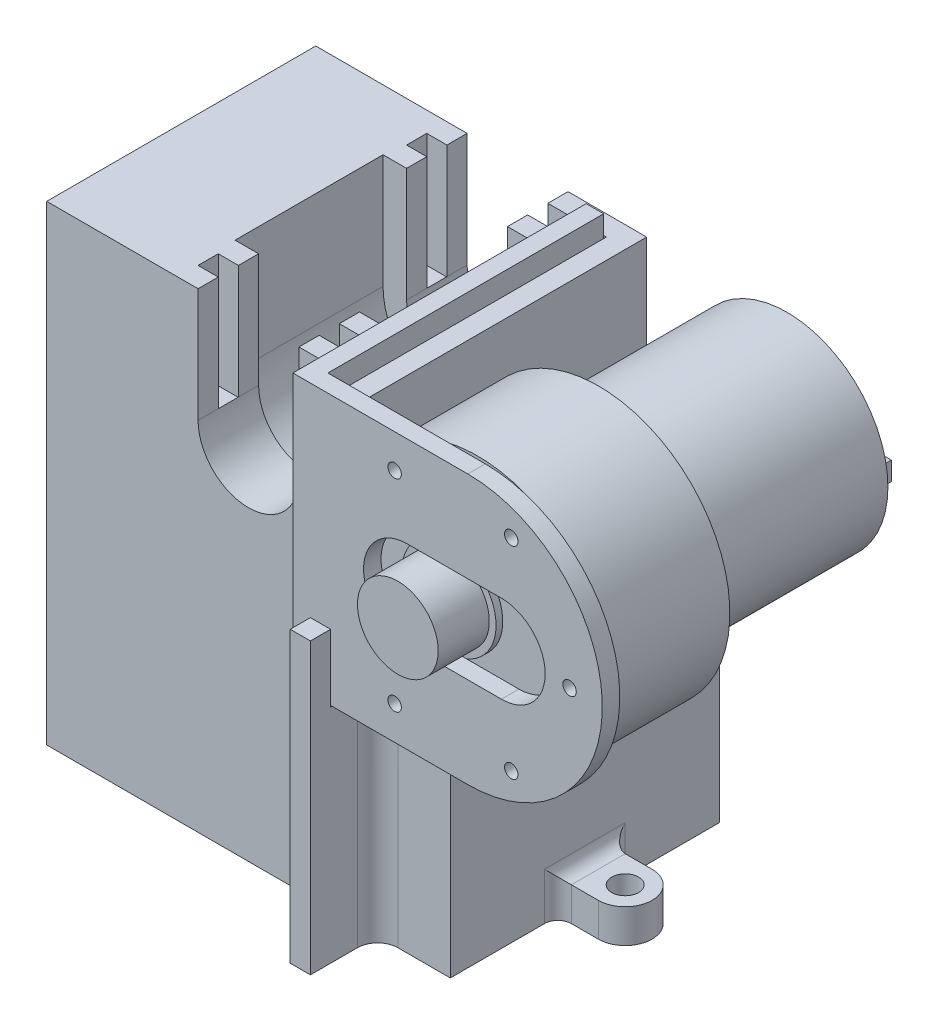
from build123d import *

# Parameters (mm, degrees)
SKETCH1_W       = 60
SKETCH1_H       = 40
EXTRUDE1_DEPTH  = 70
EXTRUDE2_DEPTH  = 173.409396496
SKETCH5_R       = 7.5
EXTRUDE3_DEPTH  = 173.409396496
SKETCH8_R       = 11
EXTRUDE5_DEPTH  = 11
SKETCH9_W       = 15
SKETCH9_H       = 16.95
EXTRUDE6_DEPTH  = 173.409396496
SKETCH10_W      = 22
SKETCH10_H      = 31.344818361
EXTRUDE7_DEPTH  = 11
SKETCH13_W      = 3
SKETCH13_H      = 17
EXTRUDE9_DEPTH  = 3
SKETCH14_W      = 3
SKETCH14_H      = 17
EXTRUDE10_DEPTH = 3
SKETCH16_W      = 3
SKETCH16_H      = 37
EXTRUDE11_DEPTH = 41
SKETCH17_W      = 3
SKETCH17_H      = 37
EXTRUDE12_DEPTH = 6
SKETCH18_W      = 3
SKETCH18_H      = 10
EXTRUDE13_DEPTH = 33
SKETCH19_W      = 3
SKETCH19_H      = 3
EXTRUDE14_DEPTH = 10
FILLET1_R       = 3
SKETCH20_R      = 2
EXTRUDE15_DEPTH = 5
FILLET2_R       = 2
FILLET3_R       = 2
EXTRUDE16_DEPTH = 40
FILLET4_RADIUS  = 20
FILLET4_LENGTH  = 2.6
EXTRUDE17_DEPTH = 2.6
SKETCH24_R      = 1
EXTRUDE18_DEPTH = 2.6
SKETCH25_R      = 2.5
EXTRUDE19_DEPTH = 2.6
SKETCH26_R      = 6
EXTRUDE20_DEPTH = 5
SKETCH27_R      = 6
EXTRUDE21_DEPTH = 2.6
SKETCH28_R      = 7
EXTRUDE22_DEPTH = 1
SKETCH29_R      = 19.5
EXTRUDE23_DEPTH = 18
SKETCH30_R      = 15
EXTRUDE24_DEPTH = 28
SKETCH31_W      = 1.052605107
SKETCH31_H      = 2.780967683
SKETCH31_W_2    = 1.226574425
EXTRUDE25_DEPTH = 3


with BuildPart() as part:
    # Sketch1 → Extrude1 (new body)
    with BuildSketch(Plane(origin=(0, 5, 0), x_dir=(1, 0, 0), z_dir=(0, 1, 0))):
        with Locations((-120, 0)):
            Rectangle(SKETCH1_W, SKETCH1_H)
    extrude(amount=EXTRUDE1_DEPTH)

    # Sketch4 → Extrude2 (cut, through all)
    with BuildSketch(Plane.XY.offset(20)):
        Polygon((-106.8, 75), (-106.8, 38), (-69.340811885, 38), (-69.340811885, 101.678315396), (-106.8, 101.678315396), align=None)
    extrude(amount=-EXTRUDE2_DEPTH, mode=Mode.SUBTRACT)

    # Sketch5 → Extrude3 (cut, through all)
    with BuildSketch(Plane.XY.offset(20)):
        with Locations((-120, 58.05)):
            Circle(SKETCH5_R)
    extrude(amount=-EXTRUDE3_DEPTH, mode=Mode.SUBTRACT)

    # Sketch8 → Extrude5 (cut, symmetric)
    with BuildSketch(Plane.XY):
        with Locations((-120, 58.05)):
            Circle(SKETCH8_R)
    extrude(amount=EXTRUDE5_DEPTH, both=True, mode=Mode.SUBTRACT)

    # Sketch9 → Extrude6 (cut, through all)
    with BuildSketch(Plane.XY.offset(20)):
        with Locations((-120, 66.525)):
            Rectangle(SKETCH9_W, SKETCH9_H)
    extrude(amount=-EXTRUDE6_DEPTH, mode=Mode.SUBTRACT)

    # Sketch10 → Extrude7 (cut, symmetric)
    with BuildSketch(Plane.XY):
        with Locations((-120, 73.722409181)):
            Rectangle(SKETCH10_W, SKETCH10_H)
    extrude(amount=EXTRUDE7_DEPTH, both=True, mode=Mode.SUBTRACT)

    # Sketch13 → Extrude9 (cut)
    with BuildSketch(Plane(origin=(-127.5, 0, 0), x_dir=(0, 0, -1), z_dir=(1, 0, 0))):
        with Locations((-15.5, 66.5)):
            Rectangle(SKETCH13_W, SKETCH13_H)
    extrude9 = extrude(amount=-EXTRUDE9_DEPTH, mode=Mode.SUBTRACT)

    # Sketch14 → Extrude10 (cut)
    with BuildSketch(Plane.ZY.offset(112.5)):
        with Locations((15.5, 66.5)):
            Rectangle(SKETCH14_W, SKETCH14_H)
    extrude10 = extrude(amount=-EXTRUDE10_DEPTH, mode=Mode.SUBTRACT)

    # Mirror1: Extrude9, Extrude10 across plane
    add(extrude9.mirror(Plane.XY), mode=Mode.SUBTRACT)
    add(extrude10.mirror(Plane.XY), mode=Mode.SUBTRACT)

    # Sketch16 → Extrude11 (add)
    with BuildSketch(Plane.XY.offset(-17)):
        with Locations((-102.3, 56.5)):
            Rectangle(SKETCH16_W, SKETCH16_H)
    extrude(amount=EXTRUDE11_DEPTH)

    # Sketch17 → Extrude12 (add)
    with BuildSketch(Plane(origin=(-100.8, 0, 0), x_dir=(0, 0, -1), z_dir=(1, 0, 0))):
        with Locations((18.5, 56.5)):
            Rectangle(SKETCH17_W, SKETCH17_H)
    extrude(amount=-EXTRUDE12_DEPTH)

    # Sketch18 → Extrude13 (add)
    with BuildSketch(Plane.XZ.offset(-38)):
        with Locations((-102.3, 25)):
            Rectangle(SKETCH18_W, SKETCH18_H)
    extrude(amount=EXTRUDE13_DEPTH)

    # Sketch19 → Extrude14 (add)
    with BuildSketch(Plane(origin=(0, 38, 0), x_dir=(1, 0, 0), z_dir=(0, 1, 0))):
        with Locations((-102.3, -28.5)):
            Rectangle(SKETCH19_W, SKETCH19_H)
    extrude(amount=EXTRUDE14_DEPTH)

    # Fillet1
    fillet1_edges = [part.edges().sort_by_distance(p)[0] for p in [
        (-100.8, 38, 0),
        (-100.8, 21.5, 20),
        (-103.8, 21.5, 20),
    ]]
    fillet(fillet1_edges, radius=FILLET1_R)

    # Sketch20 → Extrude15 (add)
    with BuildSketch(Plane.XZ.offset(-5)):
        with BuildLine():
            Line((-156, 4), (-150, 4))
            Line((-150, 4), (-150, -4))
            Line((-150, -4), (-156, -4))
            ThreePointArc((-156, -4), (-160, 0), (-156, 4))
        make_face()
        with Locations(Location((-156, 0, 0), (0, 0, 270))):
            Circle(SKETCH20_R, mode=Mode.SUBTRACT)
    extrude15 = extrude(amount=-EXTRUDE15_DEPTH)

    # Fillet2
    fillet2_edges = [part.edges().sort_by_distance(p)[0] for p in [
        (-150, 10, 0),
        (-150, 7.5, 4),
        (-150, 7.5, -4),
    ]]
    fillet(fillet2_edges, radius=FILLET2_R)

    # Mirror7: Extrude15 across plane
    add(extrude15.mirror(Plane.ZY.offset(120)))

    # Fillet3
    fillet3_edges = [part.edges().sort_by_distance(p)[0] for p in [
        (-90, 10, 0),
        (-90, 7.5, -4),
        (-90, 7.5, 4),
    ]]
    fillet(fillet3_edges, radius=FILLET3_R)

    # Sketch21 → Extrude16 (add)
    with BuildSketch(Plane(origin=(0, 38, 0), x_dir=(1, 0, 0), z_dir=(0, 1, 0))):
        Polygon((-104, -21.450806662), (-104, 16.8), (-106.6, 16.8), (-106.6, -19.806256115), (-106.6, -26.8), (-103.6, -26.8), (-101, -26.8), (-60.6, -26.8), (-60.6, -24.2), (-101, -24.2), (-103.6, -24.2), (-104, -24.2), align=None)
    extrude(amount=EXTRUDE16_DEPTH)

    # Fillet4: full round fillet: the end face becomes a half cylinder, R = half its width
    fillet4_face = Plane((-60.6, 58, 25.5), x_dir=(0, 0, -1), z_dir=(1, 0, 0))  # on the end face: x along it, z out of the body
    fillet4_slab = fillet4_face.offset(-FILLET4_RADIUS / 2) * Box(FILLET4_LENGTH, 2 * FILLET4_RADIUS, FILLET4_RADIUS, mode=Mode.PRIVATE)  # the body's end, R deep
    fillet4_round = Plane((-80.6, 58, 25.5), x_dir=(1, 0, 0), z_dir=(0, 0, -1)) * Cylinder(FILLET4_RADIUS, FILLET4_LENGTH, mode=Mode.PRIVATE)  # its axis R under the face
    add(fillet4_slab - fillet4_round, mode=Mode.SUBTRACT)

    # Sketch22 → Extrude17 (cut)
    with BuildSketch(Plane.XY.offset(26.8)):
        with BuildLine():
            Line((-89.6, 51.5), (-75.6, 51.5))
            ThreePointArc((-75.6, 51.5), (-69.1, 58), (-75.6, 64.5))
            Line((-75.6, 64.5), (-89.6, 64.5))
            ThreePointArc((-89.6, 64.5), (-96.1, 58), (-89.6, 51.5))
        make_face()
    extrude(amount=-EXTRUDE17_DEPTH, mode=Mode.SUBTRACT)

    # Sketch24 → Extrude18 (cut)
    with BuildSketch(Plane.XY.offset(26.8)):
        with Locations((-65.470800536, 58)):
            Circle(SKETCH24_R)
        with Locations((-74.138374008, 42.987322368)):
            Circle(SKETCH24_R)
        with Locations((-91.473520952, 42.987322368)):
            Circle(SKETCH24_R)
        with Locations((-100.141094423, 58)):
            Circle(SKETCH24_R)
        with Locations((-91.473520952, 73.012677632)):
            Circle(SKETCH24_R)
        with Locations((-74.138374008, 73.012677632)):
            Circle(SKETCH24_R)
    extrude(amount=-EXTRUDE18_DEPTH, mode=Mode.SUBTRACT)

    # Sketch25 → Extrude19 (add)
    with BuildSketch(Plane.XY.offset(26.8)):
        with Locations((-100.141094423, 58)):
            Circle(SKETCH25_R)
    extrude(amount=-EXTRUDE19_DEPTH)



with BuildPart() as body_2:
    # Sketch26 → Extrude20 (new body)
    with BuildSketch(Plane.XY.offset(26.8)):
        with Locations((-86, 58)):
            Circle(SKETCH26_R)
    extrude(amount=EXTRUDE20_DEPTH)

    # Sketch27 → Extrude21 (add)
    with BuildSketch(Plane(origin=(0, 0, 26.8), x_dir=(-1, 0, 0), z_dir=(0, 0, -1))):
        with Locations(Location((86, 58, 0), (0, 0, 180))):
            Circle(SKETCH27_R)
    extrude(amount=EXTRUDE21_DEPTH)


with BuildPart() as part_1:
    add(part.part)

    add(body_2.part)  # Extrude22 merges body 2
    # Sketch28 → Extrude22 (add)
    with BuildSketch(Plane(origin=(0, 0, 24.2), x_dir=(-1, 0, 0), z_dir=(0, 0, -1))):
        with Locations(Location((86, 58, 0), (0, 0, 111.786789298))):
            Circle(SKETCH28_R)
    extrude(amount=EXTRUDE22_DEPTH)

    # Sketch29 → Extrude23 (add)
    with BuildSketch(Plane(origin=(0, 0, 23.2), x_dir=(-1, 0, 0), z_dir=(0, 0, -1))):
        with Locations((82.736652481, 57.95294162)):
            Circle(SKETCH29_R)
    extrude(amount=EXTRUDE23_DEPTH)

    # Sketch30 → Extrude24 (add)
    with BuildSketch(Plane(origin=(0, 0, 5.2), x_dir=(-1, 0, 0), z_dir=(0, 0, -1))):
        with Locations(Location((82.736652481, 57.95294162, 0), (0, 0, 180))):
            Circle(SKETCH30_R)
    extrude(amount=EXTRUDE24_DEPTH)

    # Sketch31 → Extrude25 (add)
    with BuildSketch(Plane(origin=(0, 0, -22.8), x_dir=(-1, 0, 0), z_dir=(0, 0, -1))):
        with Locations((70.766955126, 57.275867088)):
            Rectangle(SKETCH31_W, SKETCH31_H)
        with Locations((95.278427538, 57.275867088)):
            Rectangle(SKETCH31_W_2, SKETCH31_H)
    extrude(amount=EXTRUDE25_DEPTH)


solid = part_1.part
